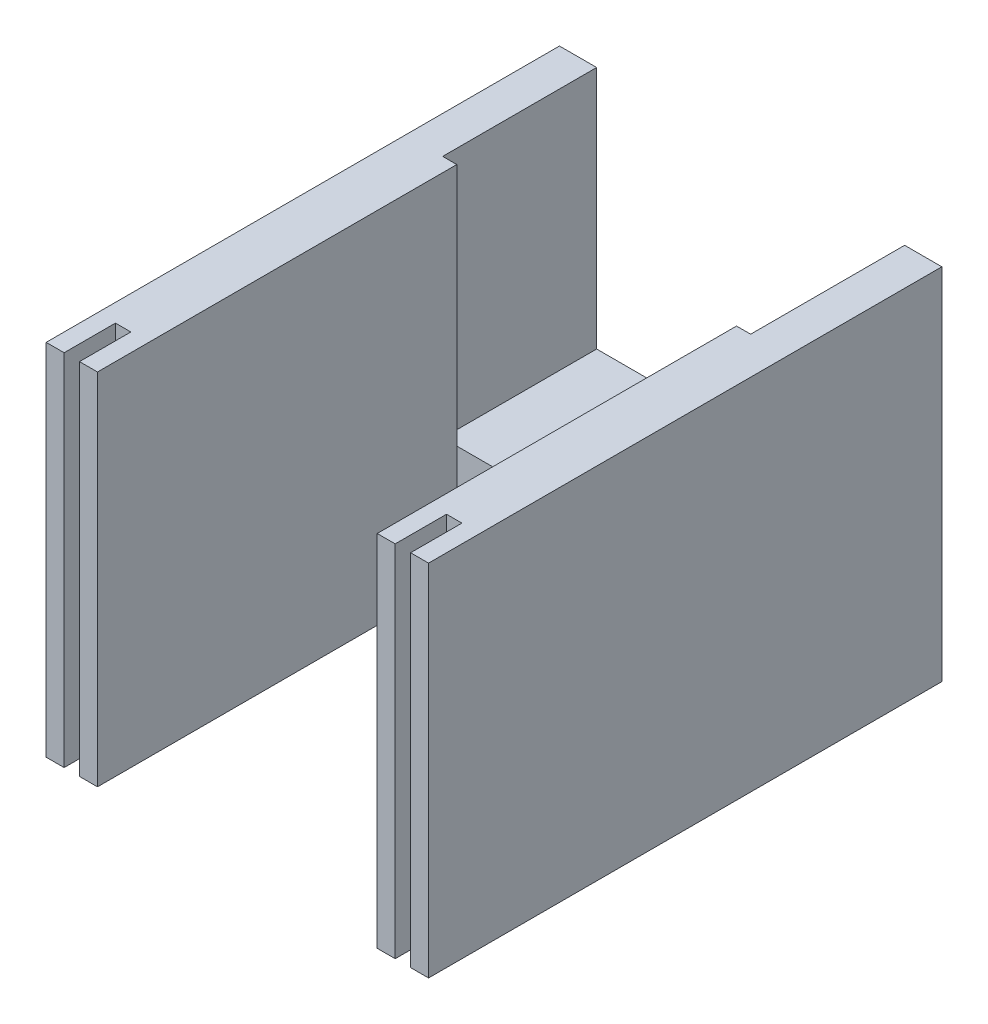
from build123d import *

# Parameters (mm, degrees)
SKETCH1_W           = 74.5
SKETCH1_H           = 100
BOSS_EXTRUDE1_DEPTH = 70
SKETCH3_W           = 54.5
SKETCH3_H           = 70
CUT_EXTRUDE1_DEPTH  = 144.004370563
SKETCH5_W           = 60
SKETCH5_H           = 30
CUT_EXTRUDE2_DEPTH  = 47.5
SKETCH6_W           = 3
SKETCH6_H           = 10
CUT_EXTRUDE3_DEPTH  = 144.004370563
SKETCH7_W           = 3
SKETCH7_H           = 10
CUT_EXTRUDE4_DEPTH  = 144.004370563
SKETCH10_W          = 50.670772636
SKETCH10_H          = 10
CUT_EXTRUDE5_DEPTH  = 144.004370563


with BuildPart() as part:
    # Sketch1 → Boss-Extrude1 (new body)
    with BuildSketch(Plane(origin=(0, 0, 0), x_dir=(1, 0, 0), z_dir=(0, 1, 0))):
        with Locations((37.25, 50)):
            Rectangle(SKETCH1_W, SKETCH1_H)
    extrude(amount=BOSS_EXTRUDE1_DEPTH)

    # Sketch3 → Cut-Extrude1 (cut, through all)
    with BuildSketch(Plane(origin=(0, 70, 0), x_dir=(1, 0, 0), z_dir=(0, 1, 0))):
        with Locations((37.25, 35)):
            Rectangle(SKETCH3_W, SKETCH3_H)
    extrude(amount=-CUT_EXTRUDE1_DEPTH, mode=Mode.SUBTRACT)

    # Sketch5 → Cut-Extrude2 (cut)
    with BuildSketch(Plane(origin=(0, 70, 0), x_dir=(1, 0, 0), z_dir=(0, 1, 0))):
        with Locations((37.25, 85)):
            Rectangle(SKETCH5_W, SKETCH5_H)
    extrude(amount=-CUT_EXTRUDE2_DEPTH, mode=Mode.SUBTRACT)

    # Sketch6 → Cut-Extrude3 (cut, through all)
    with BuildSketch(Plane(origin=(0, 70, 0), x_dir=(1, 0, 0), z_dir=(0, 1, 0))):
        with Locations((69.5, 5)):
            Rectangle(SKETCH6_W, SKETCH6_H)
    extrude(amount=-CUT_EXTRUDE3_DEPTH, mode=Mode.SUBTRACT)

    # Sketch7 → Cut-Extrude4 (cut, through all)
    with BuildSketch(Plane(origin=(0, 70, 0), x_dir=(1, 0, 0), z_dir=(0, 1, 0))):
        with Locations((5, 5)):
            Rectangle(SKETCH7_W, SKETCH7_H)
    extrude(amount=-CUT_EXTRUDE4_DEPTH, mode=Mode.SUBTRACT)

    # Sketch10 → Cut-Extrude5 (cut, through all)
    with BuildSketch(Plane(origin=(0, 0, -100), x_dir=(-1, 0, 0), z_dir=(0, 0, -1))):
        with Locations((-36.030583725, 5)):
            Rectangle(SKETCH10_W, SKETCH10_H)
    extrude(amount=-CUT_EXTRUDE5_DEPTH, mode=Mode.SUBTRACT)


solid = part.part
